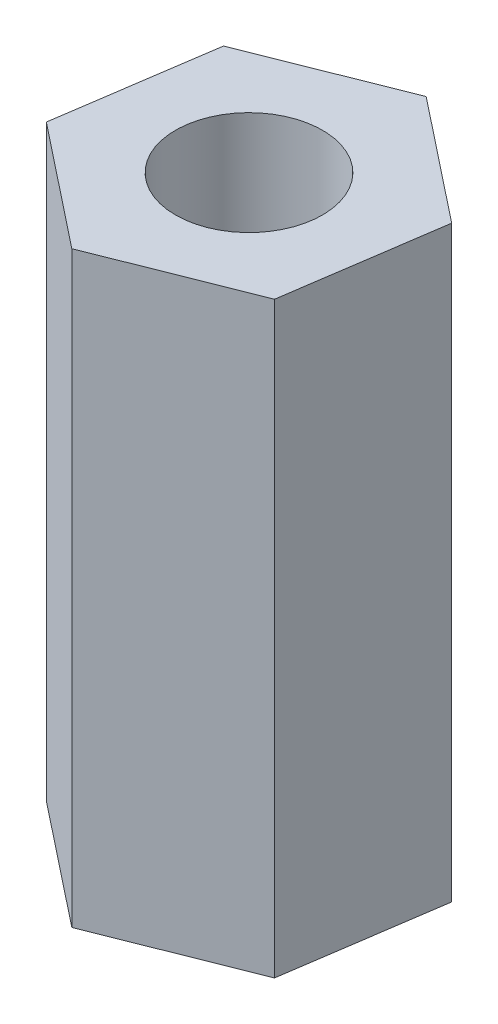
from build123d import *

# Parameters (mm, degrees)
SALIENTE_EXTRUIR1_DEPTH = 10
CROQUIS_CARA_R          = 1.25
CORTAR_EXTRUIR1_DEPTH   = 11.630085724


with BuildPart() as part:
    # Croquis base → Saliente-Extruir1 (new body)
    with BuildSketch(Plane(origin=(0, 0, 0), x_dir=(1, 0, 0), z_dir=(0, 1, 0))):
        Polygon((2.082277712, -1.648469855), (2.468755628, 0.979070469), (0.386477916, 2.627540324), (-2.082277712, 1.648469855), (-2.468755628, -0.979070469), (-0.386477916, -2.627540324), align=None)
    extrude(amount=SALIENTE_EXTRUIR1_DEPTH)

    # Croquis cara → Cortar-Extruir1 (cut, through all)
    with BuildSketch(Plane(origin=(0, 10, 0), x_dir=(1, 0, 0), z_dir=(0, 1, 0))):
        with Locations(Location((0, 0, 0), (0, 0, 270))):
            Circle(CROQUIS_CARA_R)
    extrude(amount=-CORTAR_EXTRUIR1_DEPTH, mode=Mode.SUBTRACT)


solid = part.part
